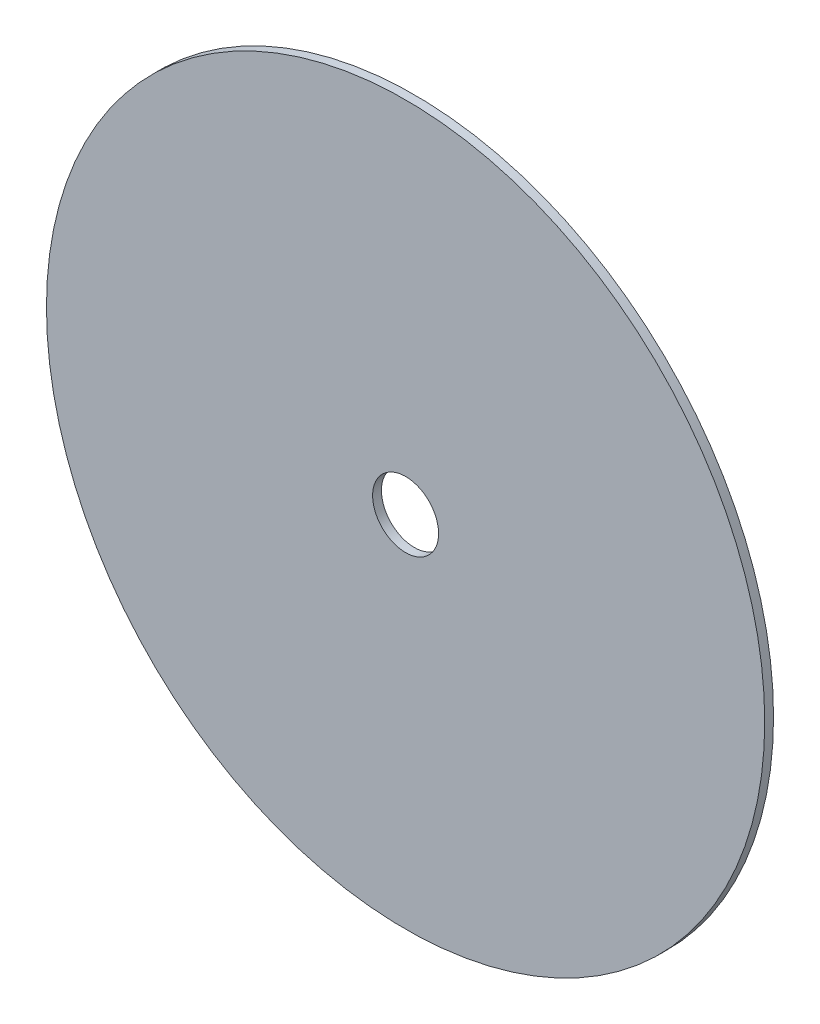
from build123d import *

# Parameters (mm, degrees)
SKETCH1_R           = 12.25
BOSS_EXTRUDE1_DEPTH = 0.3
SKETCH2_R           = 1.125
CUT_EXTRUDE1_DEPTH  = 0.3


with BuildPart() as part:
    # Sketch1 → Boss-Extrude1 (new body)
    with BuildSketch(Plane.XY):
        Circle(SKETCH1_R)
    extrude(amount=BOSS_EXTRUDE1_DEPTH)

    # Sketch2 → Cut-Extrude1 (cut)
    with BuildSketch(Plane.XY.offset(0.3)):
        Circle(SKETCH2_R)
    extrude(amount=-CUT_EXTRUDE1_DEPTH, mode=Mode.SUBTRACT)


solid = part.part
